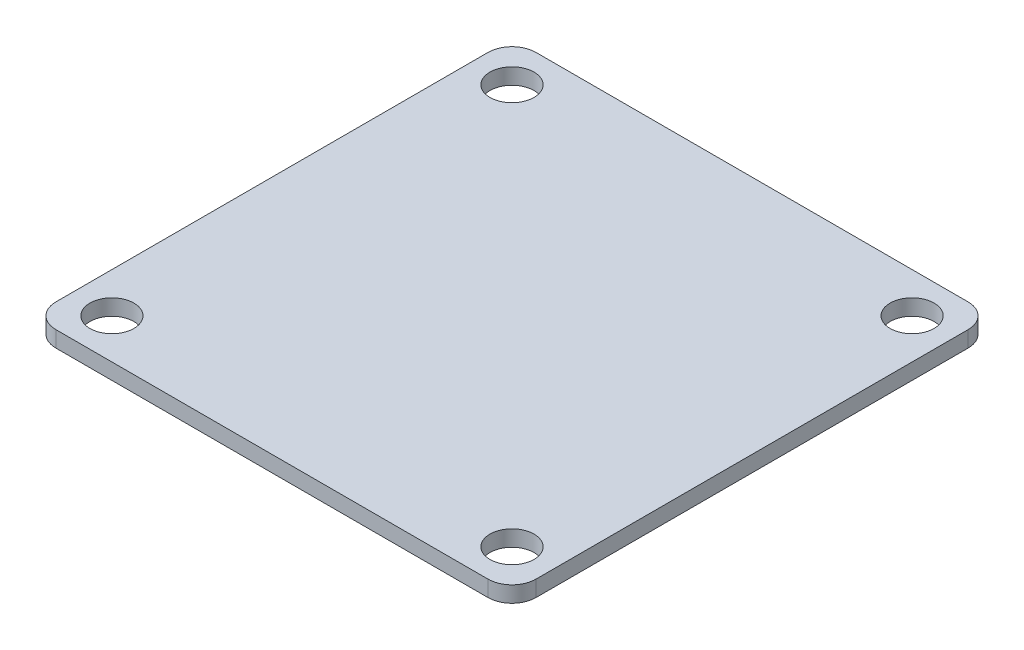
from build123d import *

# Parameters (mm, degrees)
SKETCH1_R           = 2.75
BOSS_EXTRUDE1_DEPTH = 2


with BuildPart() as part:
    # Sketch1 → Boss-Extrude1 (new body)
    with BuildSketch(Plane(origin=(0, 0, 0), x_dir=(1, 0, 0), z_dir=(0, 1, 0))):
        with BuildLine():
            Line((0, 3), (0, 57))
            ThreePointArc((0, 57), (0.878679656, 59.121320344), (3, 60))
            Line((3, 60), (57, 60))
            ThreePointArc((57, 60), (59.121320344, 59.121320344), (60, 57))
            Line((60, 57), (60, 3))
            ThreePointArc((60, 3), (59.121320344, 0.878679656), (57, 0))
            Line((57, 0), (3, 0))
            ThreePointArc((3, 0), (0.878679656, 0.878679656), (0, 3))
        make_face()
        with Locations(Location((5, 55, 0), (0, 0, 270))):
            Circle(SKETCH1_R, mode=Mode.SUBTRACT)
        with Locations(Location((5, 5, 0), (0, 0, 90))):
            Circle(SKETCH1_R, mode=Mode.SUBTRACT)
        with Locations(Location((55, 5, 0), (0, 0, 270))):
            Circle(SKETCH1_R, mode=Mode.SUBTRACT)
        with Locations(Location((55, 55, 0), (0, 0, 90))):
            Circle(SKETCH1_R, mode=Mode.SUBTRACT)
    extrude(amount=BOSS_EXTRUDE1_DEPTH)


solid = part.part
